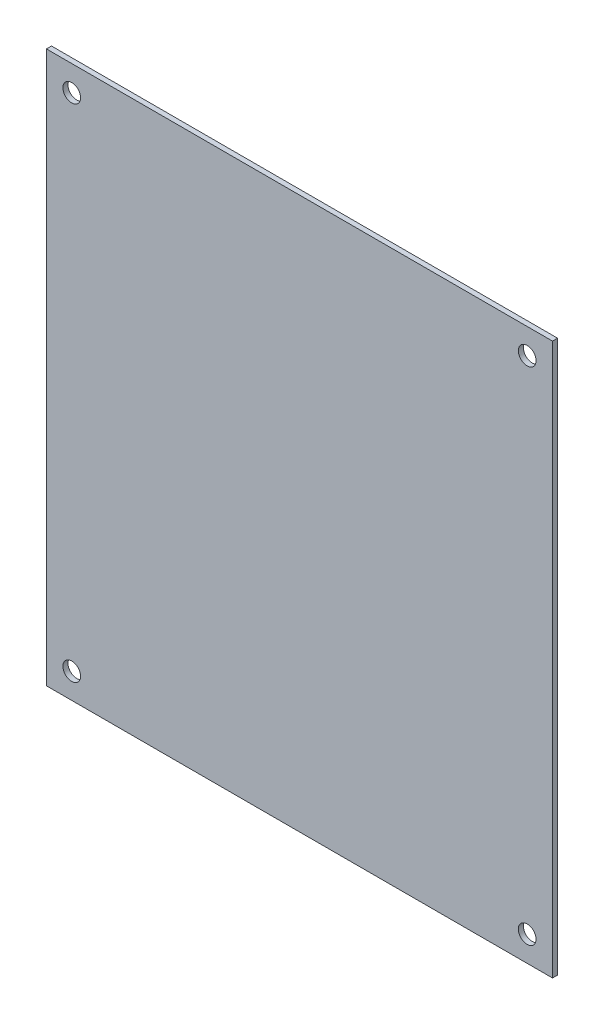
from build123d import *

# Parameters (mm, degrees)
SKETCH_1_W          = 200
SKETCH_1_H          = 218
EXTRUDE_1_DEPTH     = 2
SKETCH_2_R          = 3.5
CUT_EXTRUDE_1_DEPTH = 296.851314008


with BuildPart() as part:
    # 草图1 → 凸台-拉伸1 (new body)
    with BuildSketch(Plane.XY):
        with Locations((100, 109)):
            Rectangle(SKETCH_1_W, SKETCH_1_H)
    extrude(amount=EXTRUDE_1_DEPTH)

    # 草图2 → 切除-拉伸1 (cut, through all)
    with BuildSketch(Plane.XY.offset(2)):
        with Locations((10, 208)):
            Circle(SKETCH_2_R)
        with Locations(Location((190, 208, 0), (0, 0, 180))):
            Circle(SKETCH_2_R)
        with Locations((190, 10)):
            Circle(SKETCH_2_R)
        with Locations(Location((10, 10, 0), (0, 0, 180))):
            Circle(SKETCH_2_R)
    extrude(amount=-CUT_EXTRUDE_1_DEPTH, mode=Mode.SUBTRACT)


solid = part.part
